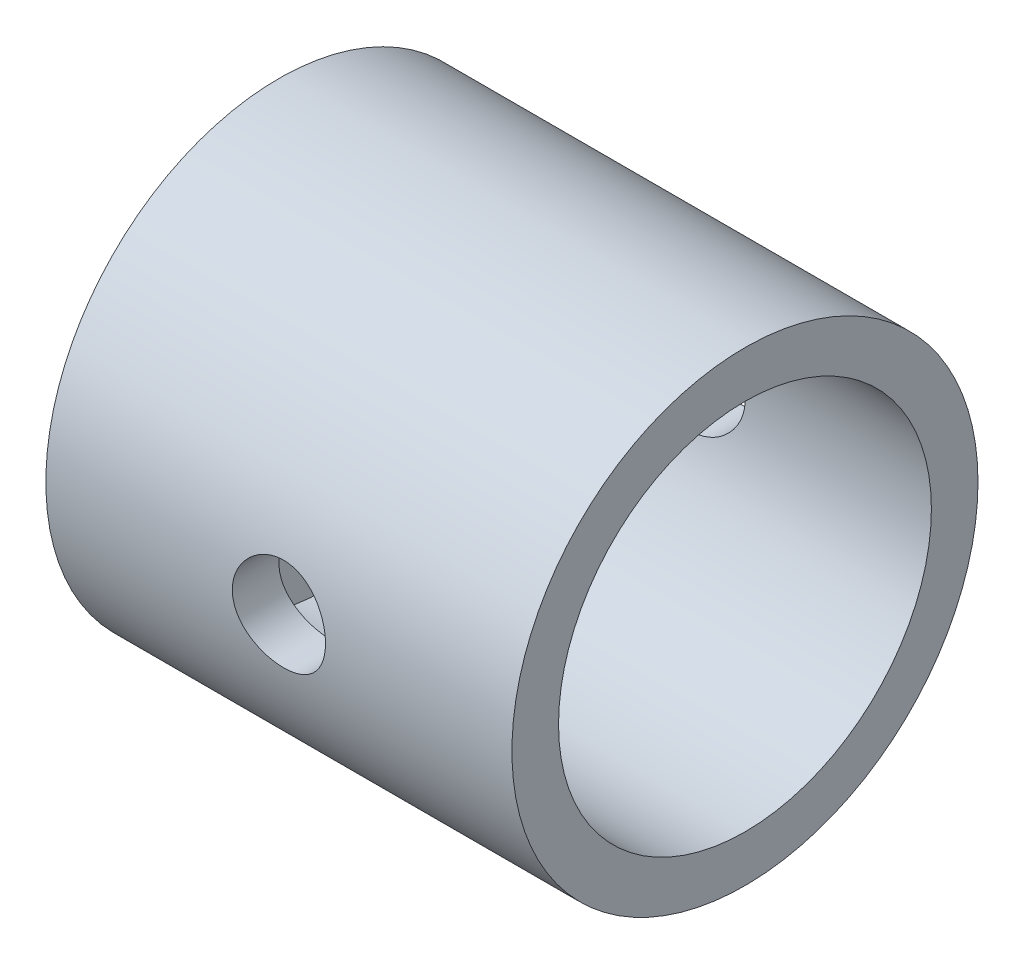
from build123d import *

# Parameters (mm, degrees)
SKETCH1_R               = 37.5
BOSS_EXTRUDE1_DEPTH     = 75
SHELL1_T                = -7.5
CUT_EXTRUDE1_DEPTH      = 92.855865354
CUT_EXTRUDE1_DEPTH_BACK = 92.855865354
SKETCH2_R               = 7.5


with BuildPart() as part:
    # Sketch1 → Boss-Extrude1 (new body)
    with BuildSketch(Plane(origin=(0, 0, 0), x_dir=(0, 0, -1), z_dir=(1, 0, 0))):
        Circle(SKETCH1_R)
    extrude(amount=BOSS_EXTRUDE1_DEPTH)

    # Shell1
    shell1_openings = [part.faces().sort_by_distance(p)[0] for p in [
        (75, 0, 0),
    ]]
    offset(amount=SHELL1_T, openings=shell1_openings, kind=Kind.INTERSECTION)

    # Sketch2 → Cut-Extrude1 (cut, two sides: drawn at the far end of the back side and taken through both)
    with BuildSketch(Plane.XY.offset(-CUT_EXTRUDE1_DEPTH_BACK)):
        with Locations((37.5, 0)):
            Circle(SKETCH2_R)
    extrude(amount=CUT_EXTRUDE1_DEPTH + CUT_EXTRUDE1_DEPTH_BACK, mode=Mode.SUBTRACT)


solid = part.part
